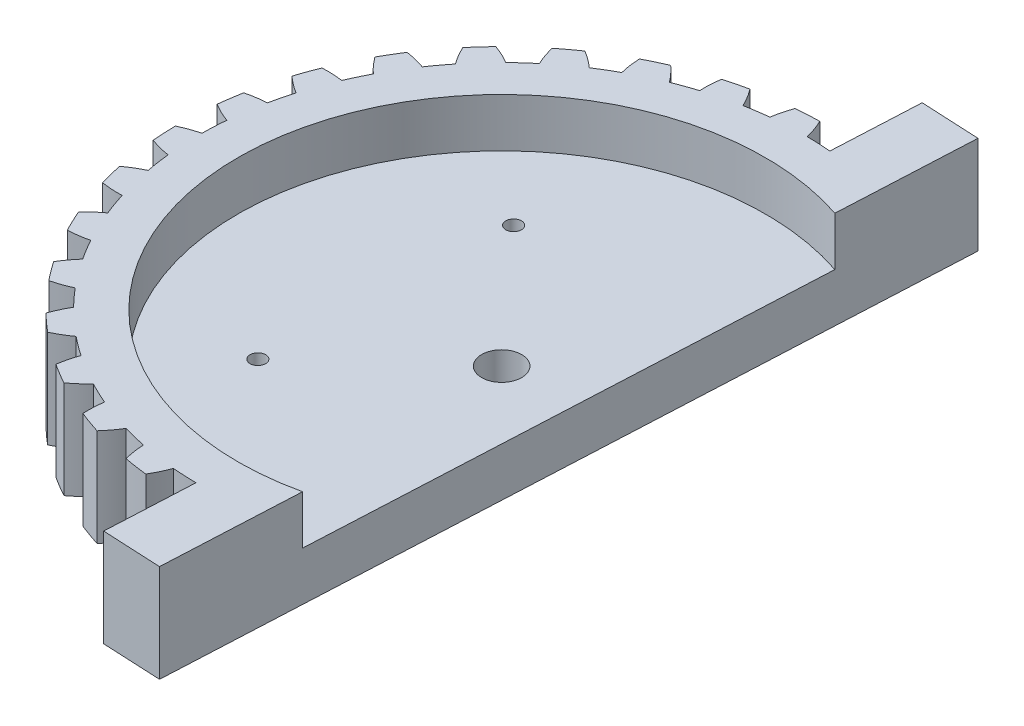
from build123d import *

# Parameters (mm, degrees)
SKETCH_5_R               = 62
EXTRUDE_5_DEPTH          = 20
EXTRUDE_6_DEPTH          = 20
PATTERN_CIRCULAR_3_COUNT = 32
SKETCH_8_R               = 54
CUT_EXTRUDE_3_DEPTH      = 10
SKETCH_7_R               = 4.1
CUT_EXTRUDE_2_DEPTH      = 96.449563275
SKETCH_6_R               = 1.6
CUT_EXTRUDE_5_DEPTH      = 94.864898271
EXTRUDE_START            = 20
EXTRUDE_8_DEPTH          = 20
SKETCH_10_R              = 3
CUT_EXTRUDE_6_DEPTH      = 2


with BuildPart() as part:
    # ｽｹｯﾁ5 → ﾎﾞｽ - 押し出し5 (new body)
    with BuildSketch(Plane(origin=(0, 0, 0), x_dir=(1, 0, 0), z_dir=(0, 1, 0))):
        with Locations(Location((0, 0, 0), (0, 0, 270))):
            Circle(SKETCH_5_R)
    extrude(amount=EXTRUDE_5_DEPTH)

    # ｽｹｯﾁ3 → ﾎﾞｽ - 押し出し6 (add)
    with BuildSketch(Plane(origin=(0, 0, 0), x_dir=(1, 0, 0), z_dir=(0, 1, 0))):
        with BuildLine():
            ThreePointArc((0.610421318, 61.996994974), (-3.042195808, 61.925318285), (-6.684250129, 61.638630746))
            add(Edge.make_bspline(
                [(-5.641686214, 65.758431981), (-5.705166523, 65.578395477), (-5.812149918, 65.264477653), (-5.954225381, 64.819801901), (-6.071216349, 64.43148887), (-6.177205967, 64.057284262), (-6.272697001, 63.69744192), (-6.358197404, 63.352203098), (-6.434220795, 63.02179612), (-6.501283354, 62.706436), (-6.559913319, 62.40632559), (-6.622924018, 62.052553392), (-6.662333587, 61.798155334), (-6.684250129, 61.638630746)],
                knots=[0, 0, 0, 0, 0.134543628, 0.233721196, 0.328992487, 0.420357503, 0.507816242, 0.591368706, 0.671014894, 0.746754806, 0.818588443, 0.886515803, 1, 1, 1, 1], degree=3))
            ThreePointArc((-5.641686214, 65.758431981), (-3.238466506, 65.92050011), (-0.830933502, 65.994769107))
            add(Edge.make_bspline(
                [(-0.830933502, 65.994769107), (-0.750112205, 65.821821686), (-0.612874637, 65.519901669), (-0.42789746, 65.091292982), (-0.273408504, 64.716316905), (-0.131250789, 64.354302994), (-0.000948853, 64.005553149), (0.117979164, 63.670357251), (0.226022029, 63.348992869), (0.323672361, 63.041724574), (0.411435971, 62.74880602), (0.508818995, 62.40291346), (0.572974167, 62.153603211), (0.610421318, 61.996994974)],
                knots=[0, 0, 0, 0, 0.134543628, 0.233721196, 0.328992487, 0.420357503, 0.507816242, 0.591368706, 0.671014894, 0.746754806, 0.818588443, 0.886515803, 1, 1, 1, 1], degree=3))
        make_face()
    extrude_6 = extrude(amount=EXTRUDE_6_DEPTH)

    # 円形ﾊﾟﾀｰﾝ3: ﾎﾞｽ - 押し出し6 ×32 about axis
    pattern_circular_3_axis = Axis((0, 20, 0), (0, 1, 0))
    for i in range(1, PATTERN_CIRCULAR_3_COUNT):
        add(extrude_6.rotate(pattern_circular_3_axis, i * 360 / PATTERN_CIRCULAR_3_COUNT))

    # ｽｹｯﾁ8 → ｶｯﾄ - 押し出し3 (cut)
    with BuildSketch(Plane(origin=(0, 20, 0), x_dir=(1, 0, 0), z_dir=(0, 1, 0))):
        with Locations(Location((0, 0, 0), (0, 0, 270))):
            Circle(SKETCH_8_R)
    extrude(amount=-CUT_EXTRUDE_3_DEPTH, mode=Mode.SUBTRACT)

    # ｽｹｯﾁ7 → ｶｯﾄ - 押し出し2 (cut, through all)
    with BuildSketch(Plane(origin=(0, 20, 0), x_dir=(1, 0, 0), z_dir=(0, 1, 0))):
        with Locations(Location((0, 0, 0), (0, 0, 270))):
            Circle(SKETCH_7_R)
        Polygon((11.294826319, -65.026355414), (62.760845246, -67.554718794), (69.080154973, 61.077785783), (17.614136047, 63.606149163), align=None)
    extrude(amount=-CUT_EXTRUDE_2_DEPTH, mode=Mode.SUBTRACT)

    # ｽｹｯﾁ6 → ｶｯﾄ - 押し出し5 (cut, through all)
    with BuildSketch(Plane(origin=(0, 10, 0), x_dir=(1, 0, 0), z_dir=(0, 1, 0))):
        with Locations(Location((-23.743194547, 26.196578263, 0), (0, 0, 270))):
            Circle(SKETCH_6_R)
        with Locations(Location((-26.196578263, -23.743194547, 0), (0, 0, 90))):
            Circle(SKETCH_6_R)
    extrude(amount=-CUT_EXTRUDE_5_DEPTH, mode=Mode.SUBTRACT)

    # ｽｹｯﾁ9 → ﾎﾞｽ - 押し出し8 (add)
    with BuildSketch(Plane(origin=(0, 0, 0), x_dir=(1, 0, 0), z_dir=(0, 1, 0)).offset(EXTRUDE_START)):
        with BuildLine():
            Line((6.354846379, 79.784286134), (5.076397488, 53.760861122))
            ThreePointArc((5.076397488, 53.760861122), (11.112838344, 52.844156006), (17.00720954, 51.251876294))
            Line((17.00720954, 51.251876294), (18.379895129, 79.193533371))
            Line((18.379895129, 79.193533371), (6.354846379, 79.784286134))
        make_face()
        with BuildLine():
            Line((-1.495981513, -80.022986859), (10.529067237, -80.613739622))
            Line((10.529067237, -80.613739622), (11.901752826, -52.672082545))
            ThreePointArc((11.901752826, -52.672082545), (5.879693935, -53.678945586), (-0.217532622, -53.999561846))
            Line((-0.217532622, -53.999561846), (-1.495981513, -80.022986859))
        make_face()
    extrude(amount=-EXTRUDE_8_DEPTH)

    # ｽｹｯﾁ10 → ｶｯﾄ - 押し出し6 (cut)
    with BuildSketch(Plane.XZ):
        with Locations(Location((-26.196578263, 23.743194547, 0), (0, 0, 270))):
            Circle(SKETCH_10_R)
        with Locations(Location((-23.743194547, -26.196578263, 0), (0, 0, 270))):
            Circle(SKETCH_10_R)
    extrude(amount=-CUT_EXTRUDE_6_DEPTH, mode=Mode.SUBTRACT)


solid = part.part
